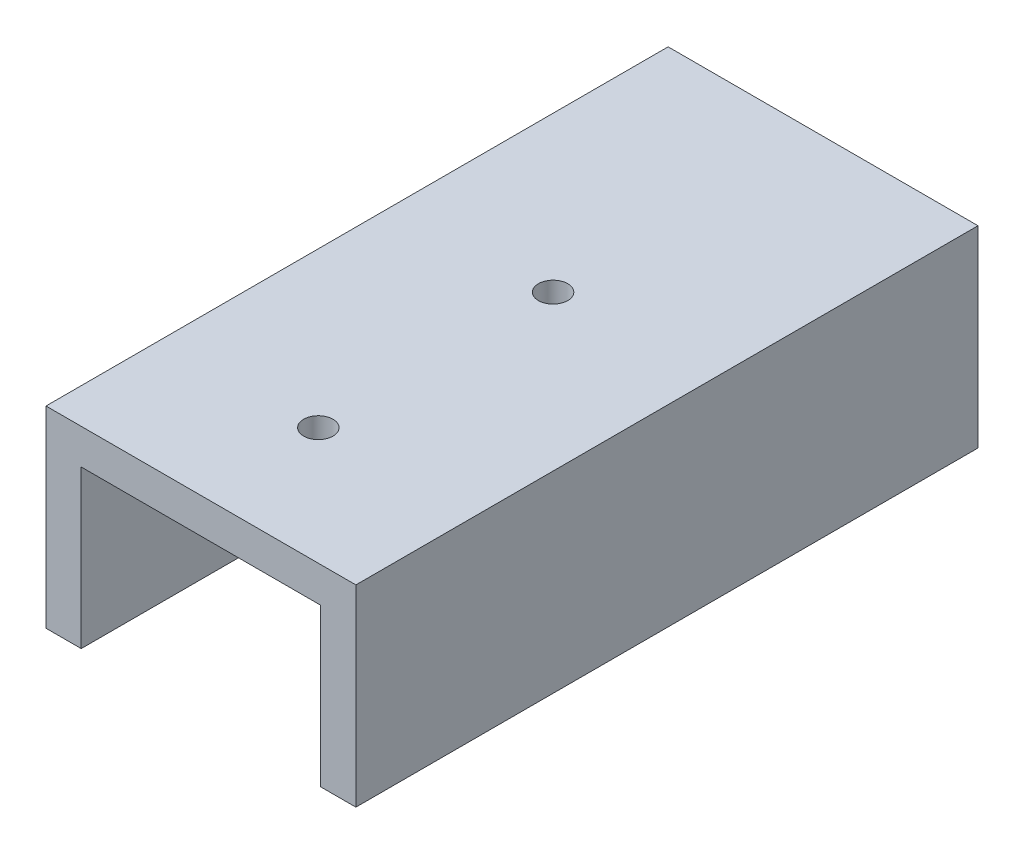
from build123d import *

# Parameters (mm, degrees)
SKETCH2_W           = 26.4
SKETCH2_H           = 26.4
SKETCH2_W_2         = 20.4
SKETCH2_H_2         = 20.4
BOSS_EXTRUDE1_DEPTH = 50
SKETCH3_W           = 26.4
SKETCH3_H           = 26.4
BOSS_EXTRUDE2_DEPTH = 3
SKETCH4_W           = 20.4
SKETCH4_H           = 50
CUT_EXTRUDE1_DEPTH  = 3
SKETCH5_W           = 26.4
SKETCH5_H           = 53
CUT_EXTRUDE2_DEPTH  = 10
SKETCH6_R           = 1.25
CUT_EXTRUDE3_DEPTH  = 10


with BuildPart() as part:
    # Sketch2 → Boss-Extrude1 (new body)
    with BuildSketch(Plane.XY):
        Rectangle(SKETCH2_W, SKETCH2_H)
        Rectangle(SKETCH2_W_2, SKETCH2_H_2, mode=Mode.SUBTRACT)
    extrude(amount=BOSS_EXTRUDE1_DEPTH)

    # Sketch3 → Boss-Extrude2 (add)
    with BuildSketch(Plane(origin=(0, 0, 0), x_dir=(-1, 0, 0), z_dir=(0, 0, -1))):
        Rectangle(SKETCH3_W, SKETCH3_H)
    extrude(amount=BOSS_EXTRUDE2_DEPTH)

    # Sketch4 → Cut-Extrude1 (cut)
    with BuildSketch(Plane.XZ.offset(13.2)):
        with Locations((0, 25)):
            Rectangle(SKETCH4_W, SKETCH4_H)
    extrude(amount=-CUT_EXTRUDE1_DEPTH, mode=Mode.SUBTRACT)

    # Sketch5 → Cut-Extrude2 (cut)
    with BuildSketch(Plane.XZ.offset(13.2)):
        with Locations((0, 23.5)):
            Rectangle(SKETCH5_W, SKETCH5_H)
    extrude(amount=-CUT_EXTRUDE2_DEPTH, mode=Mode.SUBTRACT)

    # Sketch6 → Cut-Extrude3 (cut)
    with BuildSketch(Plane(origin=(0, 13.2, 0), x_dir=(1, 0, 0), z_dir=(0, 1, 0))):
        with Locations(Location((0, -20, 0), (0, 0, 270))):
            Circle(SKETCH6_R)
        with Locations(Location((0, -40, 0), (0, 0, 270))):
            Circle(SKETCH6_R)
    extrude(amount=-CUT_EXTRUDE3_DEPTH, mode=Mode.SUBTRACT)


solid = part.part
